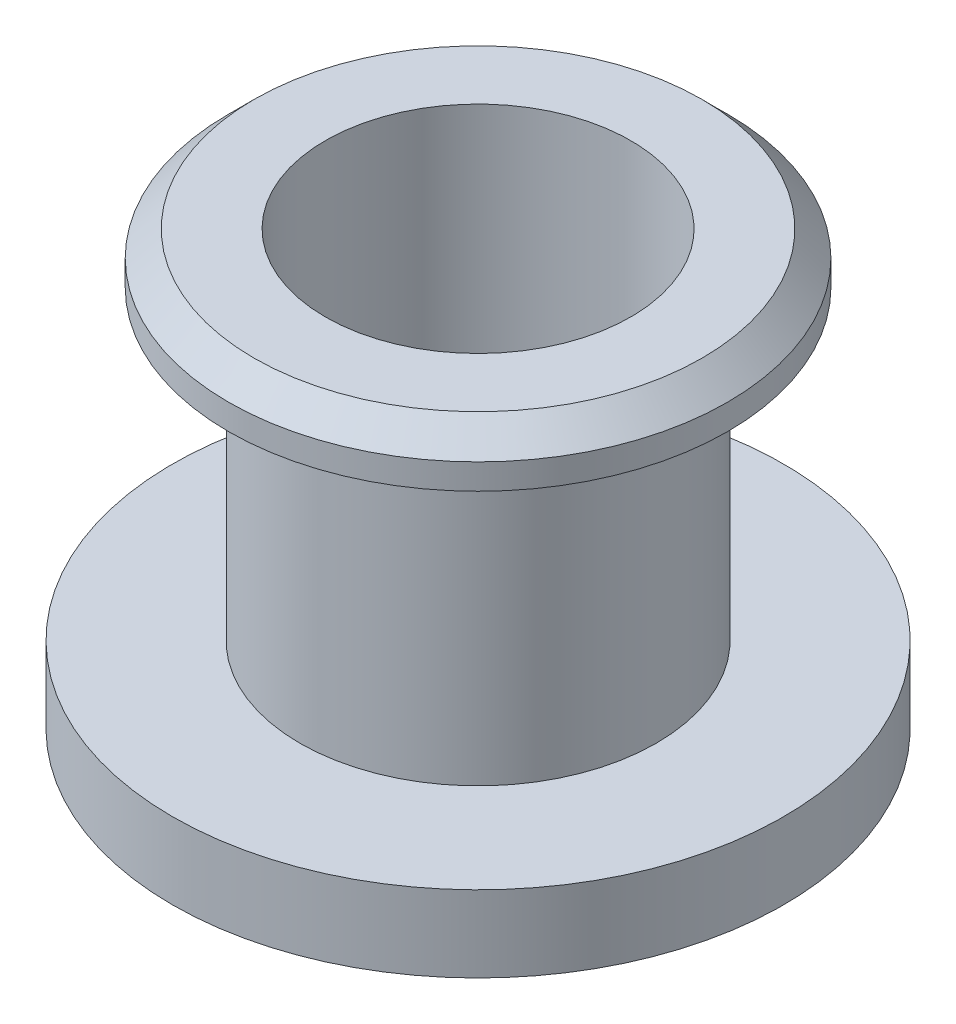
from build123d import *

# Parameters (mm, degrees)
HEADS_R                     = 6
HEAD_DEPTH                  = 1.5
TUBEENCAPSULATIONBODYS_R    = 3.5
TUBEENCAPSULATIONBODY_DEPTH = 6
TUBEACCESSS_R               = 3
TUBEACCESS_DEPTH            = 12.324751653
LOCKINGBODYS_R              = 4.9
LOCKINGBODYS_R_2            = 3
LOCKINGBODY_DEPTH           = 1
OPENCLAMPC_SIZE             = 0.5


with BuildPart() as part:
    # HeadS → Head (new body)
    with BuildSketch(Plane(origin=(0, 0, 0), x_dir=(1, 0, 0), z_dir=(0, 1, 0))):
        Circle(HEADS_R)
    extrude(amount=-HEAD_DEPTH)

    # TubeEncapsulationBodyS → TubeEncapsulationBody (add)
    with BuildSketch(Plane(origin=(0, 0, 0), x_dir=(-1, 0, 0), z_dir=(0, -1, 0))):
        Circle(TUBEENCAPSULATIONBODYS_R)
    extrude(amount=-TUBEENCAPSULATIONBODY_DEPTH)

    # TubeAccessS → TubeAccess (cut, through all)
    with BuildSketch(Plane(origin=(0, -1.5, 0), x_dir=(1, 0, 0), z_dir=(0, 1, 0))):
        Circle(TUBEACCESSS_R)
    extrude(amount=TUBEACCESS_DEPTH, mode=Mode.SUBTRACT)

    # LockingBodyS → LockingBody (add)
    with BuildSketch(Plane(origin=(0, 6, 0), x_dir=(1, 0, 0), z_dir=(0, 1, 0))):
        Circle(LOCKINGBODYS_R)
        Circle(LOCKINGBODYS_R_2, mode=Mode.SUBTRACT)
    extrude(amount=LOCKINGBODY_DEPTH)

    # OpenClampC
    openclampc_edges = [part.edges().sort_by_distance(p)[0] for p in [
        (-4.9, 7, 0),
    ]]
    chamfer(openclampc_edges, length=OPENCLAMPC_SIZE)


solid = part.part
